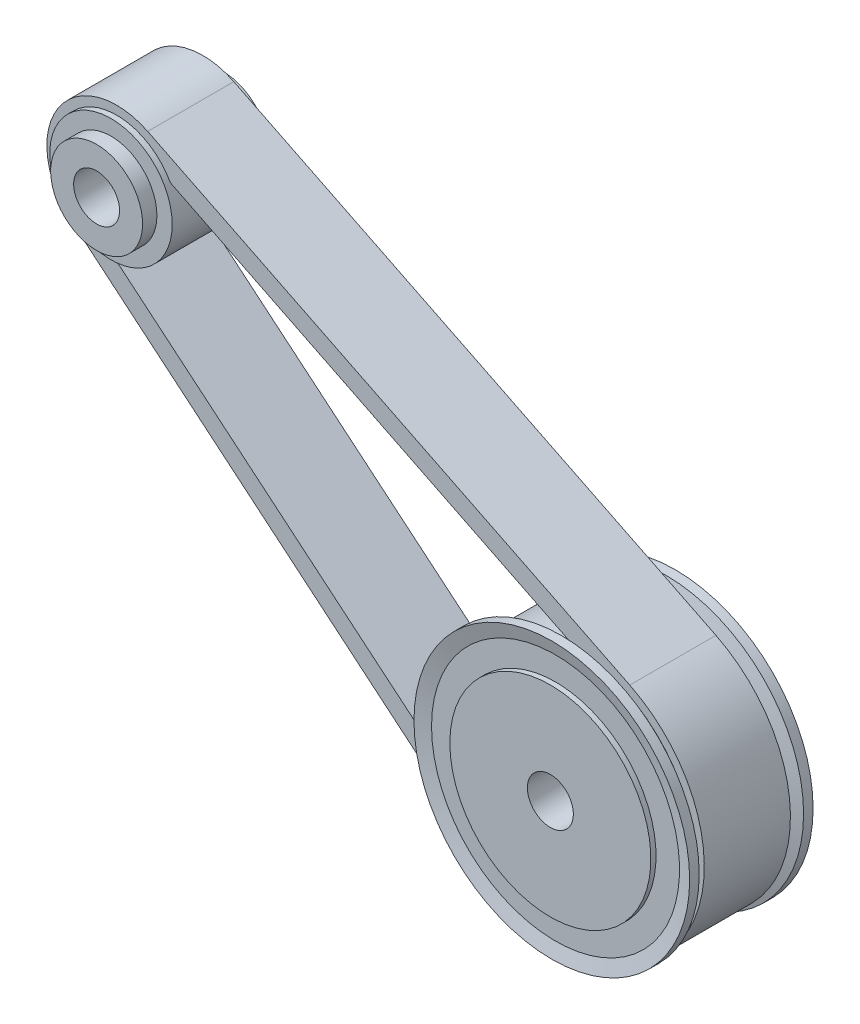
from build123d import *

# Parameters (mm, degrees)
EXTRUDE_1_DEPTH      = 7.5
EXTRUDE_1_DEPTH_BACK = 7.5


with BuildPart() as part:
    # 草图1 → 旋转1 (revolve)
    with BuildSketch(Plane(origin=(0, 0, 0), x_dir=(1, 0, 0), z_dir=(0, 1, 0))):
        Polygon((4, 0), (17.5, 0), (17.5, 0.9), (21.589095178, 0.9), (24, 0.254), (24, 1.910441889), (21.8, 2.499930112), (21.8, 19.500069888), (24, 20.089558111), (24, 21.746), (21.589095178, 21.1), (17.5, 21.1), (17.5, 22), (4, 22), align=None)
    revolve(axis=Axis((0, 0, 50), (0, 0, -1)))

    # 草图2 → 凸台-拉伸1 (add, two sides: drawn at the far end of the back side and taken through both)
    with BuildSketch(Plane.XY.offset(-11).offset(-EXTRUDE_1_DEPTH_BACK)):
        with BuildLine():
            Line((-86.797485344, 42.169146754), (-14.940905306, -17.87901979))
            ThreePointArc((-14.940905306, -17.87901979), (19.518784167, -12.724270691), (10.32945325, 20.885219548))
            Line((10.32945325, 20.885219548), (-73.609178047, 62.399754064))
            ThreePointArc((-73.609178047, 62.399754064), (-89.186627274, 58.140649425), (-86.797485344, 42.169146754))
        make_face()
        with BuildLine():
            Line((-84.610854997, 44.78577583), (-12.754274959, -15.262390713))
            ThreePointArc((-12.754274959, -15.262390713), (16.662172407, -10.862049101), (8.817717817, 17.828627331))
            Line((8.817717817, 17.828627331), (-75.120913479, 59.343161847))
            ThreePointArc((-75.120913479, 59.343161847), (-86.330015513, 56.278427835), (-84.610854997, 44.78577583))
        make_face(mode=Mode.SUBTRACT)
    extrude(amount=EXTRUDE_1_DEPTH + EXTRUDE_1_DEPTH_BACK)

    # 草图3 → 旋转2 (revolve)
    with BuildSketch(Plane(origin=(0, 51.5, 0), x_dir=(1, 0, 0), z_dir=(0, 1, 0))):
        Polygon((-89.66, 2.5), (-87, 2.5), (-87, 0), (-83, 0), (-83, 22), (-87, 22), (-87, 19.5), (-89.66, 19.5), align=None)
    revolve(axis=Axis((-79, 51.5, -50), (0, 0, 1)))


solid = part.part
